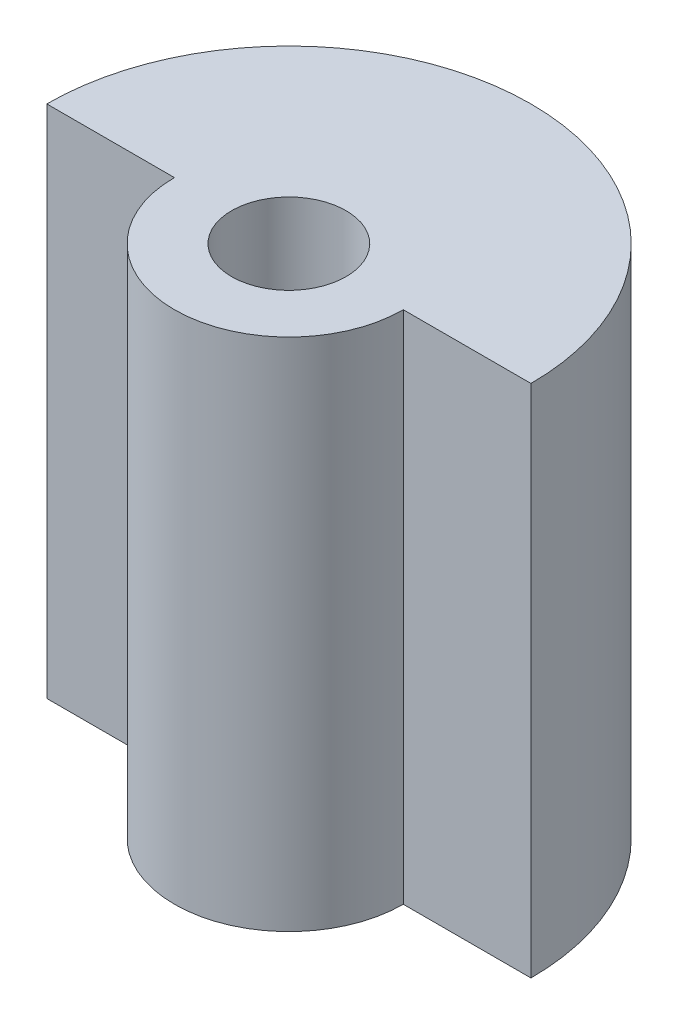
from build123d import *

# Parameters (mm, degrees)
BOSS_EXTRUDE1_DEPTH = 4.5
SKETCH2_R           = 0.5
CUT_EXTRUDE1_DEPTH  = 4.5


with BuildPart() as part:
    # Sketch1 → Boss-Extrude1 (new body)
    with BuildSketch(Plane(origin=(0, 0, 0), x_dir=(1, 0, 0), z_dir=(0, 1, 0))):
        with BuildLine():
            Line((-2.115699435, 0), (-1, 0))
            ThreePointArc((-1, 0), (0, -1), (1, 0))
            Line((1, 0), (2.115699435, 0))
            ThreePointArc((2.115699435, 0), (0, 2.115699435), (-2.115699435, 0))
        make_face()
    extrude(amount=BOSS_EXTRUDE1_DEPTH)

    # Sketch2 → Cut-Extrude1 (cut)
    with BuildSketch(Plane(origin=(0, 4.5, 0), x_dir=(1, 0, 0), z_dir=(0, 1, 0))):
        with Locations(Location((0, 0, 0), (0, 0, 270))):
            Circle(SKETCH2_R)
    extrude(amount=-CUT_EXTRUDE1_DEPTH, mode=Mode.SUBTRACT)


solid = part.part
